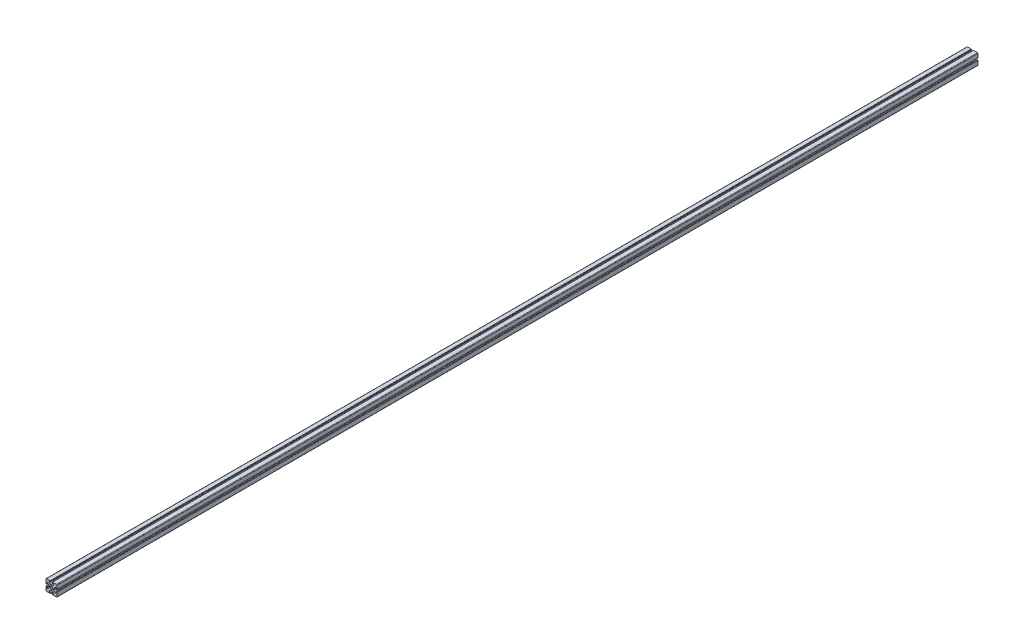
from build123d import *

# Parameters (mm, degrees)
SKETCH_1_W               = 40
SKETCH_1_H               = 40
EXTRUDE_1_DEPTH          = 3332.5
SKETCH_2_R               = 4.05
CUT_EXTRUDE_1_DEPTH      = 10000
CUT_EXTRUDE_2_DEPTH      = 10000
FILLET_1_R               = 1
PATTERN_CIRCULAR_2_COUNT = 4
FILLET_2_R               = 1
FILLET_3_R               = 1
FILLET_4_R               = 1
FILLET_5_R               = 2


with BuildPart() as part:
    # 草图1 → 凸台-拉伸1 (new body)
    with BuildSketch(Plane.XY):
        Rectangle(SKETCH_1_W, SKETCH_1_H)
    extrude(amount=EXTRUDE_1_DEPTH)

    # 草图2 → 切除-拉伸1 (cut)
    with BuildSketch(Plane.XY.offset(3332.5)):
        Circle(SKETCH_2_R)
    extrude(amount=-CUT_EXTRUDE_1_DEPTH, mode=Mode.SUBTRACT)

    # 草图4 → 切除-拉伸2 (cut)
    with BuildSketch(Plane.XY.offset(3332.5)):
        Polygon((20, 0), (20, 4), (16, 4), (16, 10.5), (7.876860985, 2.6), (7.876860985, -2.6), (16, -10.5), (16, -2.65197969), (20, -2.65197969), align=None)
    cut_extrude_2 = extrude(amount=-CUT_EXTRUDE_2_DEPTH, mode=Mode.SUBTRACT)

    # 圆角1
    fillet_1_edges = [part.edges().sort_by_distance(p)[0] for p in [
        (20, -2.65197969, 1666.25),
        (16, -2.65197969, 1666.25),
        (16, -10.5, 1666.25),
        (7.876860985, -2.6, 1666.25),
        (7.876860985, 2.6, 1666.25),
        (16, 10.5, 1666.25),
        (16, 4, 1666.25),
        (20, 4, 1666.25),
    ]]
    fillet(fillet_1_edges, radius=FILLET_1_R)

    # 阵列(圆周)2: 切除-拉伸2 ×4 about axis
    pattern_circular_2_axis = Axis((0, 0, 0), (0, 0, 1))
    for i in range(1, PATTERN_CIRCULAR_2_COUNT):
        add(cut_extrude_2.rotate(pattern_circular_2_axis, i * 360 / PATTERN_CIRCULAR_2_COUNT), mode=Mode.SUBTRACT)

    # 圆角2
    fillet_2_edges = [part.edges().sort_by_distance(p)[0] for p in [
        (2.65197969, 20, 1666.25),
        (2.65197969, 16, 1666.25),
        (10.5, 16, 1666.25),
        (2.6, 7.876860985, 1666.25),
        (-2.6, 7.876860985, 1666.25),
        (-10.5, 16, 1666.25),
        (-4, 16, 1666.25),
        (-4, 20, 1666.25),
    ]]
    fillet(fillet_2_edges, radius=FILLET_2_R)

    # 圆角3
    fillet_3_edges = [part.edges().sort_by_distance(p)[0] for p in [
        (-20, 2.65197969, 1666.25),
        (-16, 2.65197969, 1666.25),
        (-16, 10.5, 1666.25),
        (-7.876860985, 2.6, 1666.25),
        (-7.876860985, -2.6, 1666.25),
        (-16, -10.5, 1666.25),
        (-16, -4, 1666.25),
        (-20, -4, 1666.25),
    ]]
    fillet(fillet_3_edges, radius=FILLET_3_R)

    # 圆角4
    fillet_4_edges = [part.edges().sort_by_distance(p)[0] for p in [
        (-2.65197969, -20, 1666.25),
        (-2.65197969, -16, 1666.25),
        (-10.5, -16, 1666.25),
        (-2.6, -7.876860985, 1666.25),
        (2.6, -7.876860985, 1666.25),
        (10.5, -16, 1666.25),
        (4, -16, 1666.25),
        (4, -20, 1666.25),
    ]]
    fillet(fillet_4_edges, radius=FILLET_4_R)

    # 圆角5
    fillet_5_edges = [part.edges().sort_by_distance(p)[0] for p in [
        (-20, 20, 1666.25),
        (-20, -20, 1666.25),
        (20, -20, 1666.25),
        (20, 20, 1666.25),
    ]]
    fillet(fillet_5_edges, radius=FILLET_5_R)


solid = part.part
